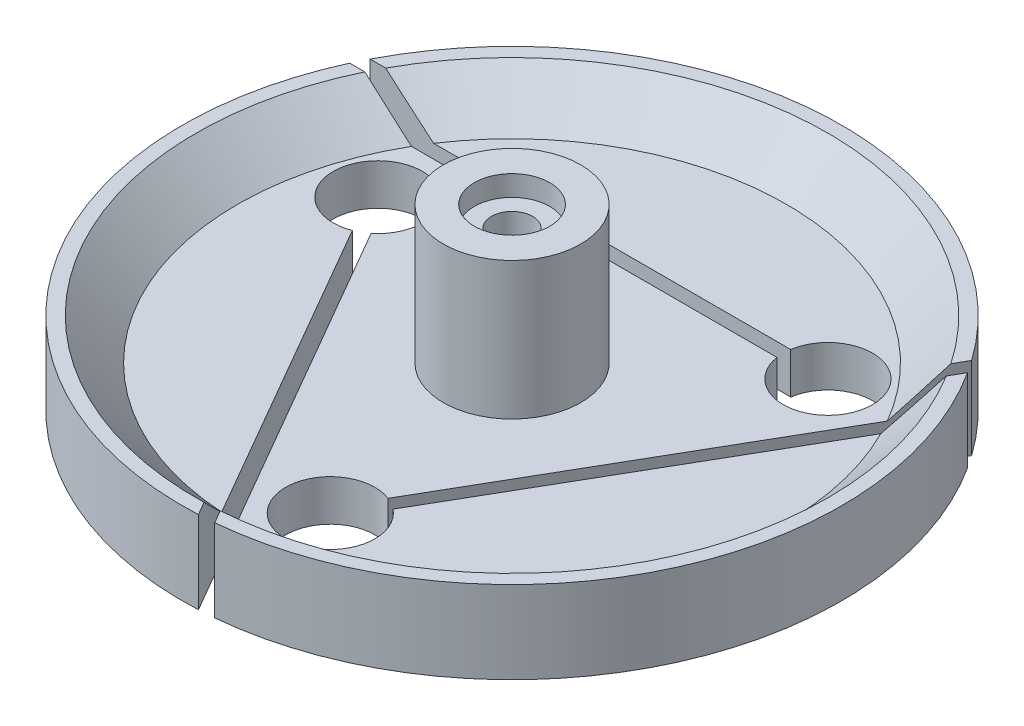
from build123d import *

# Parameters (mm, degrees)
CUT_EXTRUDE_START        = -15
CUT_EXTRUDE_1_DEPTH      = 15
PATTERN_CIRCULAR_1_COUNT = 3


with BuildPart() as part:
    # 草图2 → 旋转1 (revolve)
    with BuildSketch(Plane.XY):
        Polygon((3, 0), (48, 0), (48, 12), (46, 12), (40, 6), (10, 6), (10, 26), (5.5, 26), (5.5, 23), (3, 23), align=None)
    revolve(axis=Axis((0, -31.681818182, 0), (0, 1, 0)))

    # 草图4 → 切除-拉伸1 (cut)
    with BuildSketch(Plane(origin=(0, 0, 0), x_dir=(-1, 0, 0), z_dir=(0, -1, 0)).offset(CUT_EXTRUDE_START)):
        with BuildLine():
            Line((-18.577383711, 20), (43.634848459, 20))
            ThreePointArc((43.634848459, 20), (43.159739663, 21.005639058), (42.661458015, 22))
            Line((42.661458015, 22), (-18.577383711, 22))
            ThreePointArc((-18.577383711, 22), (-31.5, 21), (-18.577383711, 20))
        make_face()
    cut_extrude_1 = extrude(amount=CUT_EXTRUDE_1_DEPTH, mode=Mode.SUBTRACT)

    # 阵列(圆周)1: 切除-拉伸1 ×3 about axis
    pattern_circular_1_axis = Axis((0, 27.3, 0), (0, -1, 0))
    for i in range(1, PATTERN_CIRCULAR_1_COUNT):
        add(cut_extrude_1.rotate(pattern_circular_1_axis, i * 360 / PATTERN_CIRCULAR_1_COUNT), mode=Mode.SUBTRACT)


solid = part.part
